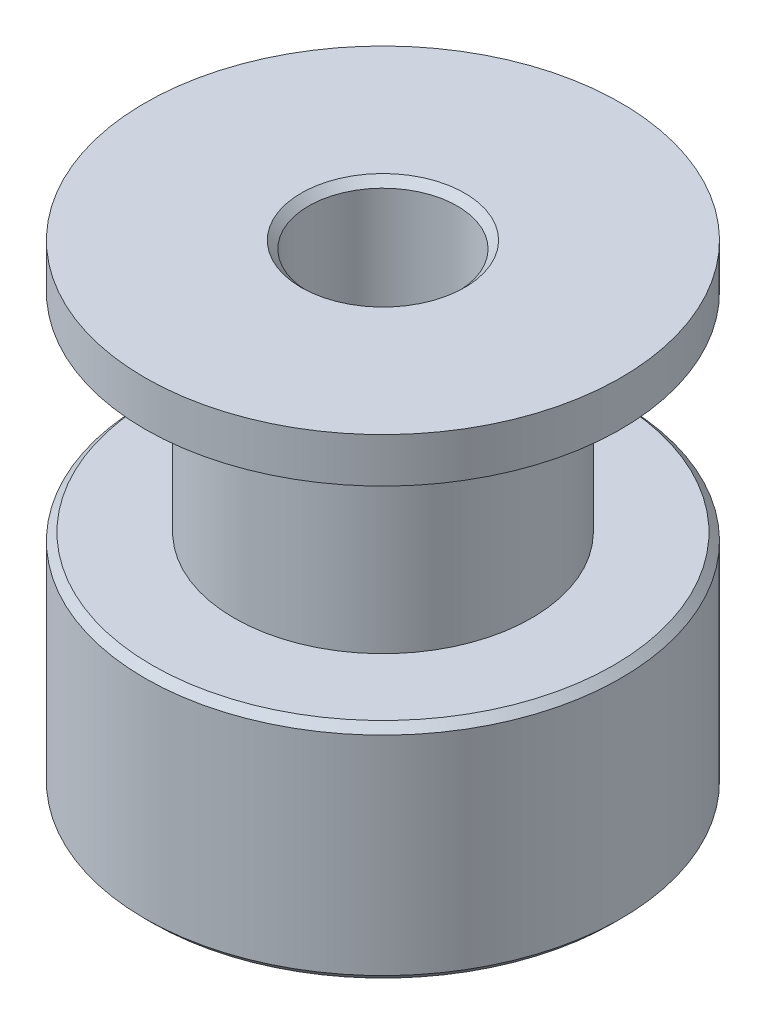
from build123d import *

# Parameters (mm, degrees)
SKETCH1_R           = 8
BOSS_EXTRUDE1_DEPTH = 16
SKETCH2_R           = 2.5
CUT_EXTRUDE1_DEPTH  = 16
SKETCH3_W           = 3
SKETCH3_H           = 7
CHAMFER1_SIZE       = 0.25


with BuildPart() as part:
    # Sketch1 → Boss-Extrude1 (new body)
    with BuildSketch(Plane(origin=(0, 0, 0), x_dir=(1, 0, 0), z_dir=(0, 1, 0))):
        with Locations(Location((0, 0, 0), (0, 0, 270))):
            Circle(SKETCH1_R)
    extrude(amount=BOSS_EXTRUDE1_DEPTH)

    # Sketch2 → Cut-Extrude1 (cut)
    with BuildSketch(Plane(origin=(0, 16, 0), x_dir=(1, 0, 0), z_dir=(0, 1, 0))):
        with Locations(Location((0, 0, 0), (0, 0, 270))):
            Circle(SKETCH2_R)
    extrude(amount=-CUT_EXTRUDE1_DEPTH, mode=Mode.SUBTRACT)

    # Sketch3 → Cut-Revolve1 (revolve, cut)
    with BuildSketch(Plane.XY, mode=Mode.PRIVATE) as cut_revolve1_sk:
        with Locations((6.5, 11)):
            Rectangle(SKETCH3_W, SKETCH3_H)
    revolve(cut_revolve1_sk.sketch.rotate(Axis((0, 16, 0), (0, -1, 0)), 90), axis=Axis((0, 16, 0), (0, -1, 0)), mode=Mode.SUBTRACT)

    # Chamfer1
    chamfer1_edges = [part.edges().sort_by_distance(p)[0] for p in [
        (0, 7.5, -8),
        (0, 0, -8),
        (0, 16, -2.5),
        (0, 0, -2.5),
    ]]
    chamfer(chamfer1_edges, length=CHAMFER1_SIZE)


solid = part.part
